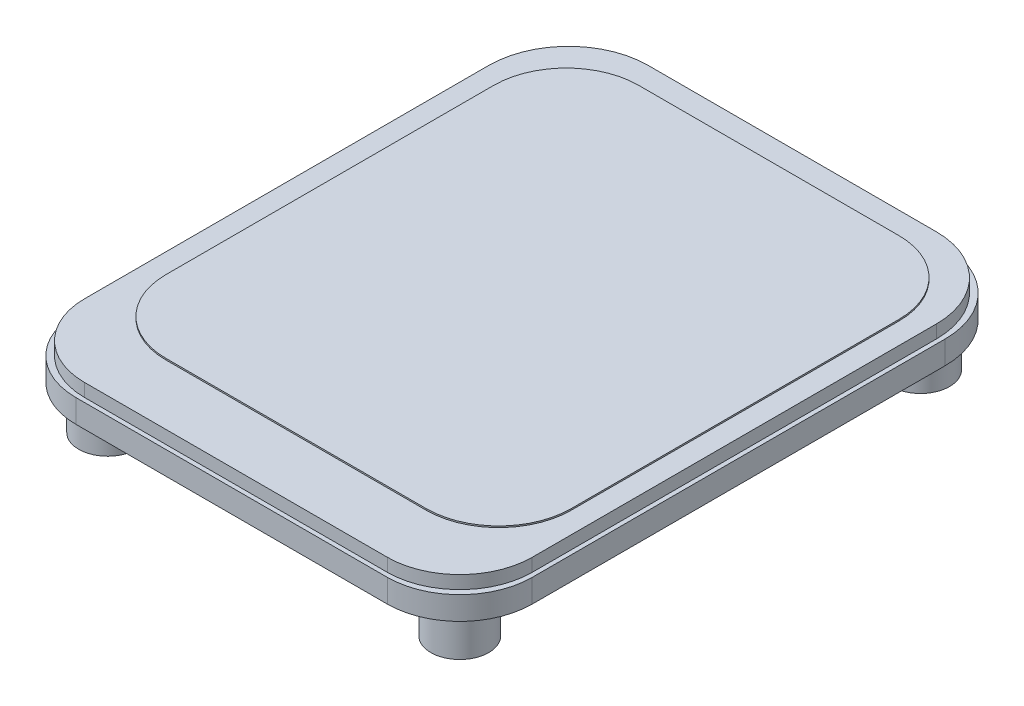
from build123d import *

# Parameters (mm, degrees)
EXTRUDE_1_DEPTH = 1.6
EXTRUDE_2_DEPTH = 1
EXTRUDE_3_DEPTH = 0.9
SKETCH_4_R      = 2
SKETCH_4_R_2    = 1
EXTRUDE_4_DEPTH = 3


with BuildPart() as part:
    # 草图1 → 凸台-拉伸1 (new body)
    with BuildSketch(Plane(origin=(0, 0, 0), x_dir=(1, 0, 0), z_dir=(0, 1, 0))):
        with BuildLine():
            Line((-10.25, 19.5), (10.25, 19.5))
            ThreePointArc((10.25, 19.5), (14.139087297, 17.889087297), (15.75, 14))
            Line((15.75, 14), (15.75, -14.5))
            ThreePointArc((15.75, -14.5), (14.285533906, -18.035533906), (10.75, -19.5))
            Line((10.75, -19.5), (-10.75, -19.5))
            ThreePointArc((-10.75, -19.5), (-14.285533906, -18.035533906), (-15.75, -14.5))
            Line((-15.75, -14.5), (-15.75, 14))
            ThreePointArc((-15.75, 14), (-14.139087297, 17.889087297), (-10.25, 19.5))
        make_face()
    extrude(amount=EXTRUDE_1_DEPTH)

    # 草图2 → 凸台-拉伸2 (add)
    with BuildSketch(Plane(origin=(0, 1.6, 0), x_dir=(1, 0, 0), z_dir=(0, 1, 0))):
        with BuildLine():
            Line((-8.985, 17.58), (8.985, 17.58))
            ThreePointArc((8.985, 17.58), (12.520533906, 16.115533906), (13.985, 12.58))
            Line((13.985, 12.58), (13.985, -10.05))
            ThreePointArc((13.985, -10.05), (12.520533906, -13.585533906), (8.985, -15.05))
            Line((8.985, -15.05), (-8.985, -15.05))
            ThreePointArc((-8.985, -15.05), (-12.520533906, -13.585533906), (-13.985, -10.05))
            Line((-13.985, -10.05), (-13.985, 12.58))
            ThreePointArc((-13.985, 12.58), (-12.520533906, 16.115533906), (-8.985, 17.58))
        make_face()
    extrude(amount=EXTRUDE_2_DEPTH)

    # 草图3 → 凸台-拉伸3 (add)
    with BuildSketch(Plane(origin=(0, 1.6, 0), x_dir=(1, 0, 0), z_dir=(0, 1, 0))):
        with BuildLine():
            Line((-9.95, 19.2), (9.95, 19.2))
            ThreePointArc((9.95, 19.2), (13.839087297, 17.589087297), (15.45, 13.7))
            Line((15.45, 13.7), (15.45, -14.2))
            ThreePointArc((15.45, -14.2), (13.985533906, -17.735533906), (10.45, -19.2))
            Line((10.45, -19.2), (-10.45, -19.2))
            ThreePointArc((-10.45, -19.2), (-13.985533906, -17.735533906), (-15.45, -14.2))
            Line((-15.45, -14.2), (-15.45, 13.7))
            ThreePointArc((-15.45, 13.7), (-13.839087297, 17.589087297), (-9.95, 19.2))
        make_face()
    extrude(amount=EXTRUDE_3_DEPTH)

    # 草图4 → 凸台-拉伸4 (add)
    # profile 1 of 4: a face of its own
    with BuildSketch(Plane.XZ):
        with Locations(Location((-12.15, 15.9, 0), (0, 0, 270))):
            Circle(SKETCH_4_R)
        with Locations(Location((-12.15, 15.9, 0), (0, 0, 270))):
            Circle(SKETCH_4_R_2, mode=Mode.SUBTRACT)
    # profile 2 of 4: a face of its own
    with BuildSketch(Plane.XZ):
        with Locations(Location((12.15, 15.9, 0), (0, 0, 270))):
            Circle(SKETCH_4_R)
        with Locations(Location((12.15, 15.9, 0), (0, 0, 270))):
            Circle(SKETCH_4_R_2, mode=Mode.SUBTRACT)
    # profile 3 of 4: a face of its own
    with BuildSketch(Plane.XZ):
        with Locations(Location((12.15, -15.9, 0), (0, 0, 270))):
            Circle(SKETCH_4_R)
        with Locations(Location((12.15, -15.9, 0), (0, 0, 270))):
            Circle(SKETCH_4_R_2, mode=Mode.SUBTRACT)
    # profile 4 of 4: a face of its own
    with BuildSketch(Plane.XZ):
        with Locations(Location((-12.15, -15.9, 0), (0, 0, 270))):
            Circle(SKETCH_4_R)
        with Locations(Location((-12.15, -15.9, 0), (0, 0, 270))):
            Circle(SKETCH_4_R_2, mode=Mode.SUBTRACT)
    extrude(amount=EXTRUDE_4_DEPTH)


solid = part.part
